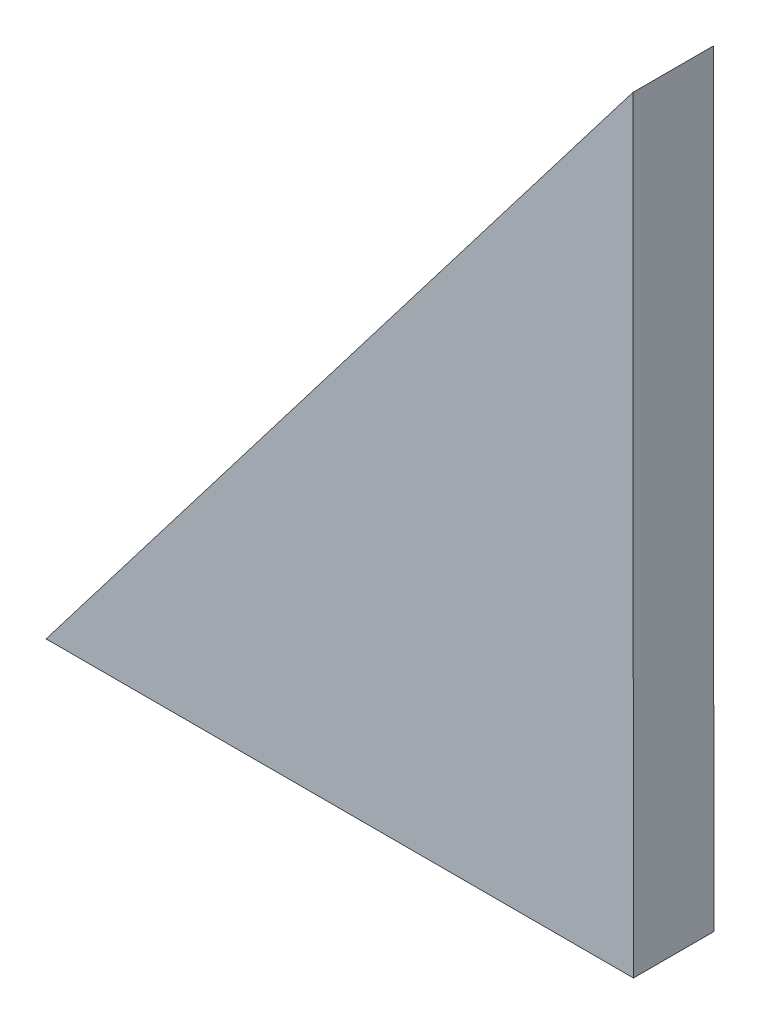
from build123d import *

# Parameters (mm, degrees)
EXTRUDE1_DEPTH = 12.7


with BuildPart() as part:
    # Sketch1 → Extrude1 (new body)
    with BuildSketch(Plane.XY):
        Polygon((-0.101081025, 121.020305138), (0, 0), (-92.728537777, 0), align=None)
    extrude(amount=EXTRUDE1_DEPTH)


solid = part.part
